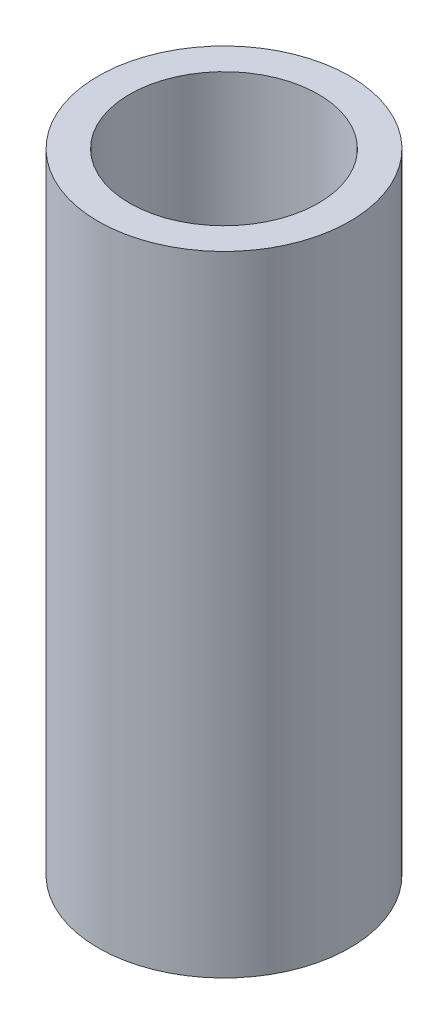
from build123d import *

# Parameters (mm, degrees)
SKETCH12_R              = 10
SKETCH12_R_2            = 7.5
PIPE_21_3_X_2_3_1_DEPTH = 50


with BuildPart() as part:
    # Sketch12 → Pipe 21.3 X 2.3(1) (new body)
    with BuildSketch(Plane(origin=(0, 0, 0), x_dir=(1, 0, 0), z_dir=(0, 1, 0))):
        Circle(SKETCH12_R)
        Circle(SKETCH12_R_2, mode=Mode.SUBTRACT)
    extrude(amount=PIPE_21_3_X_2_3_1_DEPTH)


solid = part.part
